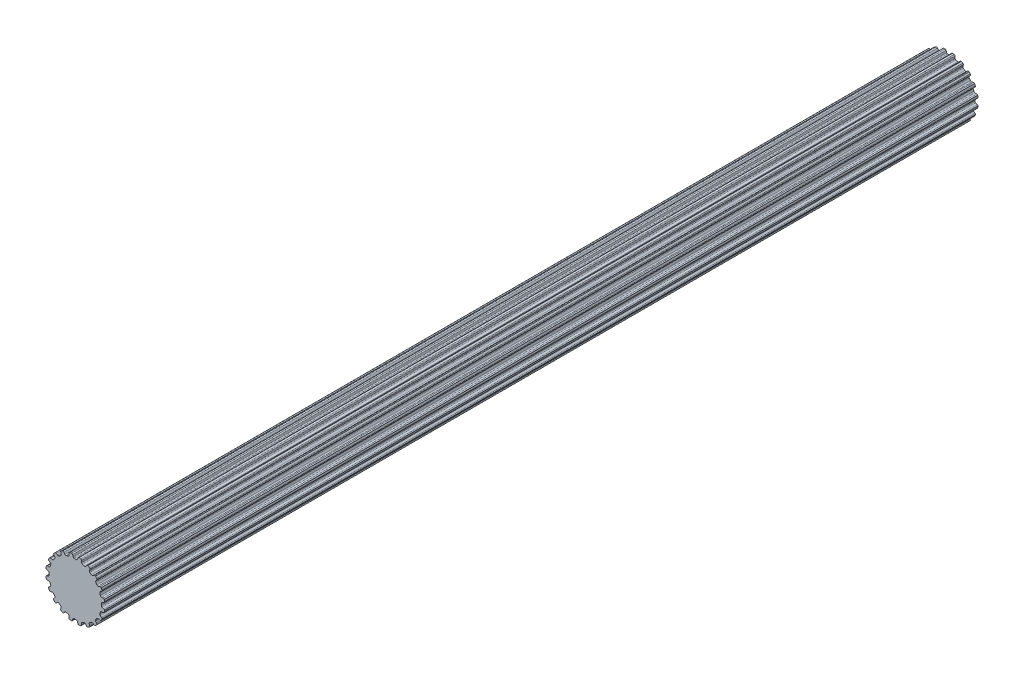
from build123d import *

# Parameters (mm, degrees)
BOSS_EXTRUDE1_DEPTH = 49.657


with BuildPart() as part:
    # Sketch1 → Boss-Extrude1 (new, symmetric)
    with BuildSketch(Plane.XY):
        with BuildLine():
            Line((-0.106949245, 2.969874934), (0.106949245, 2.969874934))
            ThreePointArc((0.106949245, 2.969874934), (0.196343213, 2.986924176), (0.253739238, 3.057547504))
            Line((0.253739238, 3.057547504), (0.315888147, 3.237526941))
            ThreePointArc((0.315888147, 3.237526941), (0.359032156, 3.298322911), (0.4281449, 3.326269005))
            Line((0.4281449, 3.326269005), (0.620027588, 3.2937547))
            ThreePointArc((0.620027588, 3.2937547), (0.689621142, 3.24802576), (0.718272212, 3.169836791))
            Line((0.718272212, 3.169836791), (0.724389167, 2.979527391))
            ThreePointArc((0.724389167, 2.979527391), (0.750934762, 2.9040661), (0.816027049, 2.857568043))
            Line((0.816027049, 2.857568043), (1.019456602, 2.791469774))
            ThreePointArc((1.019456602, 2.791469774), (1.109743823, 2.780060312), (1.186154496, 2.829490741))
            Line((1.186154496, 2.829490741), (1.300878326, 2.981456288))
            ThreePointArc((1.300878326, 2.981456288), (1.360697704, 3.02594446), (1.435063648, 3.031165762))
            Line((1.435063648, 3.031165762), (1.607507455, 2.940947809))
            ThreePointArc((1.607507455, 2.940947809), (1.659563839, 2.875951412), (1.662650905, 2.792735615))
            Line((1.662650905, 2.792735615), (1.609659636, 2.609850378))
            ThreePointArc((1.609659636, 2.609850378), (1.611587176, 2.529879385), (1.659124931, 2.465542482))
            Line((1.659124931, 2.465542482), (1.832172444, 2.339816104))
            ThreePointArc((1.832172444, 2.339816104), (1.914514976, 2.301064775), (2.002460687, 2.32446371))
            Line((2.002460687, 2.32446371), (2.158529469, 2.433539921))
            ThreePointArc((2.158529469, 2.433539921), (2.229168681, 2.457365482), (2.301508367, 2.439350895))
            Line((2.301508367, 2.439350895), (2.437633293, 2.300260456))
            ThreePointArc((2.437633293, 2.300260456), (2.467056864, 2.222358901), (2.444277744, 2.14226202))
            Line((2.444277744, 2.14226202), (2.337365406, 1.984703026))
            ThreePointArc((2.337365406, 1.984703026), (2.314486209, 1.908050449), (2.339816104, 1.832172444))
            Line((2.339816104, 1.832172444), (2.465542482, 1.659124931))
            ThreePointArc((2.465542482, 1.659124931), (2.531880064, 1.596824985), (2.622752074, 1.591901975))
            Line((2.622752074, 1.591901975), (2.804888709, 1.64741171))
            ThreePointArc((2.804888709, 1.64741171), (2.879433095, 1.648242449), (2.942665411, 1.608755366))
            Line((2.942665411, 1.608755366), (3.0291466, 1.434407582))
            ThreePointArc((3.0291466, 1.434407582), (3.033057175, 1.351226417), (2.986641646, 1.282088892))
            Line((2.986641646, 1.282088892), (2.836273564, 1.165279113))
            ThreePointArc((2.836273564, 1.165279113), (2.790827206, 1.099448241), (2.791469774, 1.019456602))
            Line((2.791469774, 1.019456602), (2.857568043, 0.816027049))
            ThreePointArc((2.857568043, 0.816027049), (2.901407091, 0.736276839), (2.986310214, 0.703513784))
            Line((2.986310214, 0.703513784), (3.1766859, 0.700023363))
            ThreePointArc((3.1766859, 0.700023363), (3.247838536, 0.677777961), (3.295773863, 0.620683653))
            Line((3.295773863, 0.620683653), (3.324145932, 0.4281449))
            ThreePointArc((3.324145932, 0.4281449), (3.302160717, 0.347826477), (3.236652255, 0.29641597))
            Line((3.236652255, 0.29641597), (3.057547504, 0.231789562))
            ThreePointArc((3.057547504, 0.231789562), (2.993982591, 0.183224379), (2.969874934, 0.106949245))
            Line((2.969874934, 0.106949245), (2.969874934, -0.106949245))
            ThreePointArc((2.969874934, -0.106949245), (2.986924176, -0.196343213), (3.057547504, -0.253739238))
            Line((3.057547504, -0.253739238), (3.237526941, -0.315888147))
            ThreePointArc((3.237526941, -0.315888147), (3.298322911, -0.359032156), (3.326269005, -0.4281449))
            Line((3.326269005, -0.4281449), (3.2937547, -0.620027588))
            ThreePointArc((3.2937547, -0.620027588), (3.24802576, -0.689621142), (3.169836791, -0.718272212))
            Line((3.169836791, -0.718272212), (2.979527391, -0.724389167))
            ThreePointArc((2.979527391, -0.724389167), (2.9040661, -0.750934762), (2.857568043, -0.816027049))
            Line((2.857568043, -0.816027049), (2.791469774, -1.019456602))
            ThreePointArc((2.791469774, -1.019456602), (2.780060312, -1.109743823), (2.829490741, -1.186154496))
            Line((2.829490741, -1.186154496), (2.981456288, -1.300878326))
            ThreePointArc((2.981456288, -1.300878326), (3.02594446, -1.360697704), (3.031165762, -1.435063648))
            Line((3.031165762, -1.435063648), (2.940947809, -1.607507455))
            ThreePointArc((2.940947809, -1.607507455), (2.875951412, -1.659563839), (2.792735615, -1.662650905))
            Line((2.792735615, -1.662650905), (2.609850378, -1.609659636))
            ThreePointArc((2.609850378, -1.609659636), (2.529879385, -1.611587176), (2.465542482, -1.659124931))
            Line((2.465542482, -1.659124931), (2.339816104, -1.832172444))
            ThreePointArc((2.339816104, -1.832172444), (2.301064775, -1.914514976), (2.32446371, -2.002460687))
            Line((2.32446371, -2.002460687), (2.433539921, -2.158529469))
            ThreePointArc((2.433539921, -2.158529469), (2.457365482, -2.229168681), (2.439350895, -2.301508367))
            Line((2.439350895, -2.301508367), (2.300260456, -2.437633293))
            ThreePointArc((2.300260456, -2.437633293), (2.222358901, -2.467056864), (2.14226202, -2.444277744))
            Line((2.14226202, -2.444277744), (1.984703026, -2.337365406))
            ThreePointArc((1.984703026, -2.337365406), (1.908050449, -2.314486209), (1.832172444, -2.339816104))
            Line((1.832172444, -2.339816104), (1.659124931, -2.465542482))
            ThreePointArc((1.659124931, -2.465542482), (1.596824985, -2.531880064), (1.591901975, -2.622752074))
            Line((1.591901975, -2.622752074), (1.64741171, -2.804888709))
            ThreePointArc((1.64741171, -2.804888709), (1.648242449, -2.879433095), (1.608755366, -2.942665411))
            Line((1.608755366, -2.942665411), (1.434407582, -3.0291466))
            ThreePointArc((1.434407582, -3.0291466), (1.351226417, -3.033057175), (1.282088892, -2.986641646))
            Line((1.282088892, -2.986641646), (1.165279113, -2.836273564))
            ThreePointArc((1.165279113, -2.836273564), (1.099448241, -2.790827206), (1.019456602, -2.791469774))
            Line((1.019456602, -2.791469774), (0.816027049, -2.857568043))
            ThreePointArc((0.816027049, -2.857568043), (0.736276839, -2.901407091), (0.703513784, -2.986310214))
            Line((0.703513784, -2.986310214), (0.700023363, -3.1766859))
            ThreePointArc((0.700023363, -3.1766859), (0.677777961, -3.247838536), (0.620683653, -3.295773863))
            Line((0.620683653, -3.295773863), (0.4281449, -3.324145932))
            ThreePointArc((0.4281449, -3.324145932), (0.347826477, -3.302160717), (0.29641597, -3.236652255))
            Line((0.29641597, -3.236652255), (0.231789562, -3.057547504))
            ThreePointArc((0.231789562, -3.057547504), (0.183224379, -2.993982591), (0.106949245, -2.969874934))
            Line((0.106949245, -2.969874934), (-0.106949245, -2.969874934))
            ThreePointArc((-0.106949245, -2.969874934), (-0.196343213, -2.986924176), (-0.253739238, -3.057547504))
            Line((-0.253739238, -3.057547504), (-0.315888147, -3.237526941))
            ThreePointArc((-0.315888147, -3.237526941), (-0.359032156, -3.298322911), (-0.4281449, -3.326269005))
            Line((-0.4281449, -3.326269005), (-0.620027588, -3.2937547))
            ThreePointArc((-0.620027588, -3.2937547), (-0.689621142, -3.24802576), (-0.718272212, -3.169836791))
            Line((-0.718272212, -3.169836791), (-0.724389167, -2.979527391))
            ThreePointArc((-0.724389167, -2.979527391), (-0.750934762, -2.9040661), (-0.816027049, -2.857568043))
            Line((-0.816027049, -2.857568043), (-1.019456602, -2.791469774))
            ThreePointArc((-1.019456602, -2.791469774), (-1.109743823, -2.780060312), (-1.186154496, -2.829490741))
            Line((-1.186154496, -2.829490741), (-1.300878326, -2.981456288))
            ThreePointArc((-1.300878326, -2.981456288), (-1.360697704, -3.02594446), (-1.435063648, -3.031165762))
            Line((-1.435063648, -3.031165762), (-1.607507455, -2.940947809))
            ThreePointArc((-1.607507455, -2.940947809), (-1.659563839, -2.875951412), (-1.662650905, -2.792735615))
            Line((-1.662650905, -2.792735615), (-1.609659636, -2.609850378))
            ThreePointArc((-1.609659636, -2.609850378), (-1.611587176, -2.529879385), (-1.659124931, -2.465542482))
            Line((-1.659124931, -2.465542482), (-1.832172444, -2.339816104))
            ThreePointArc((-1.832172444, -2.339816104), (-1.914514976, -2.301064775), (-2.002460687, -2.32446371))
            Line((-2.002460687, -2.32446371), (-2.158529469, -2.433539921))
            ThreePointArc((-2.158529469, -2.433539921), (-2.229168681, -2.457365482), (-2.301508367, -2.439350895))
            Line((-2.301508367, -2.439350895), (-2.437633293, -2.300260456))
            ThreePointArc((-2.437633293, -2.300260456), (-2.467056864, -2.222358901), (-2.444277744, -2.14226202))
            Line((-2.444277744, -2.14226202), (-2.337365406, -1.984703026))
            ThreePointArc((-2.337365406, -1.984703026), (-2.314486209, -1.908050449), (-2.339816104, -1.832172444))
            Line((-2.339816104, -1.832172444), (-2.465542482, -1.659124931))
            ThreePointArc((-2.465542482, -1.659124931), (-2.531880064, -1.596824985), (-2.622752074, -1.591901975))
            Line((-2.622752074, -1.591901975), (-2.804888709, -1.64741171))
            ThreePointArc((-2.804888709, -1.64741171), (-2.879433095, -1.648242449), (-2.942665411, -1.608755366))
            Line((-2.942665411, -1.608755366), (-3.0291466, -1.434407582))
            ThreePointArc((-3.0291466, -1.434407582), (-3.033057175, -1.351226417), (-2.986641646, -1.282088892))
            Line((-2.986641646, -1.282088892), (-2.836273564, -1.165279113))
            ThreePointArc((-2.836273564, -1.165279113), (-2.790827206, -1.099448241), (-2.791469774, -1.019456602))
            Line((-2.791469774, -1.019456602), (-2.857568043, -0.816027049))
            ThreePointArc((-2.857568043, -0.816027049), (-2.901407091, -0.736276839), (-2.986310214, -0.703513784))
            Line((-2.986310214, -0.703513784), (-3.1766859, -0.700023363))
            ThreePointArc((-3.1766859, -0.700023363), (-3.247838536, -0.677777961), (-3.295773863, -0.620683653))
            Line((-3.295773863, -0.620683653), (-3.324145932, -0.4281449))
            ThreePointArc((-3.324145932, -0.4281449), (-3.302160717, -0.347826477), (-3.236652255, -0.29641597))
            Line((-3.236652255, -0.29641597), (-3.057547504, -0.231789562))
            ThreePointArc((-3.057547504, -0.231789562), (-2.993982591, -0.183224379), (-2.969874934, -0.106949245))
            Line((-2.969874934, -0.106949245), (-2.969874934, 0.106949245))
            ThreePointArc((-2.969874934, 0.106949245), (-2.986924176, 0.196343213), (-3.057547504, 0.253739238))
            Line((-3.057547504, 0.253739238), (-3.237526941, 0.315888147))
            ThreePointArc((-3.237526941, 0.315888147), (-3.298322911, 0.359032156), (-3.326269005, 0.4281449))
            Line((-3.326269005, 0.4281449), (-3.2937547, 0.620027588))
            ThreePointArc((-3.2937547, 0.620027588), (-3.24802576, 0.689621142), (-3.169836791, 0.718272212))
            Line((-3.169836791, 0.718272212), (-2.979527391, 0.724389167))
            ThreePointArc((-2.979527391, 0.724389167), (-2.9040661, 0.750934762), (-2.857568043, 0.816027049))
            Line((-2.857568043, 0.816027049), (-2.791469774, 1.019456602))
            ThreePointArc((-2.791469774, 1.019456602), (-2.780060312, 1.109743823), (-2.829490741, 1.186154496))
            Line((-2.829490741, 1.186154496), (-2.981456288, 1.300878326))
            ThreePointArc((-2.981456288, 1.300878326), (-3.02594446, 1.360697704), (-3.031165762, 1.435063648))
            Line((-3.031165762, 1.435063648), (-2.940947809, 1.607507455))
            ThreePointArc((-2.940947809, 1.607507455), (-2.875951412, 1.659563839), (-2.792735615, 1.662650905))
            Line((-2.792735615, 1.662650905), (-2.609850378, 1.609659636))
            ThreePointArc((-2.609850378, 1.609659636), (-2.529879385, 1.611587176), (-2.465542482, 1.659124931))
            Line((-2.465542482, 1.659124931), (-2.339816104, 1.832172444))
            ThreePointArc((-2.339816104, 1.832172444), (-2.301064775, 1.914514976), (-2.32446371, 2.002460687))
            Line((-2.32446371, 2.002460687), (-2.433539921, 2.158529469))
            ThreePointArc((-2.433539921, 2.158529469), (-2.457365482, 2.229168681), (-2.439350895, 2.301508367))
            Line((-2.439350895, 2.301508367), (-2.300260456, 2.437633293))
            ThreePointArc((-2.300260456, 2.437633293), (-2.222358901, 2.467056864), (-2.14226202, 2.444277744))
            Line((-2.14226202, 2.444277744), (-1.984703026, 2.337365406))
            ThreePointArc((-1.984703026, 2.337365406), (-1.908050449, 2.314486209), (-1.832172444, 2.339816104))
            Line((-1.832172444, 2.339816104), (-1.659124931, 2.465542482))
            ThreePointArc((-1.659124931, 2.465542482), (-1.596824985, 2.531880064), (-1.591901975, 2.622752074))
            Line((-1.591901975, 2.622752074), (-1.64741171, 2.804888709))
            ThreePointArc((-1.64741171, 2.804888709), (-1.648242449, 2.879433095), (-1.608755366, 2.942665411))
            Line((-1.608755366, 2.942665411), (-1.434407582, 3.0291466))
            ThreePointArc((-1.434407582, 3.0291466), (-1.351226417, 3.033057175), (-1.282088892, 2.986641646))
            Line((-1.282088892, 2.986641646), (-1.165279113, 2.836273564))
            ThreePointArc((-1.165279113, 2.836273564), (-1.099448241, 2.790827206), (-1.019456602, 2.791469774))
            Line((-1.019456602, 2.791469774), (-0.816027049, 2.857568043))
            ThreePointArc((-0.816027049, 2.857568043), (-0.736276839, 2.901407091), (-0.703513784, 2.986310214))
            Line((-0.703513784, 2.986310214), (-0.700023363, 3.1766859))
            ThreePointArc((-0.700023363, 3.1766859), (-0.677777961, 3.247838536), (-0.620683653, 3.295773863))
            Line((-0.620683653, 3.295773863), (-0.4281449, 3.324145932))
            ThreePointArc((-0.4281449, 3.324145932), (-0.347826477, 3.302160717), (-0.29641597, 3.236652255))
            Line((-0.29641597, 3.236652255), (-0.231789562, 3.057547504))
            ThreePointArc((-0.231789562, 3.057547504), (-0.183224379, 2.993982591), (-0.106949245, 2.969874934))
        make_face()
    extrude(amount=BOSS_EXTRUDE1_DEPTH, both=True)


solid = part.part
